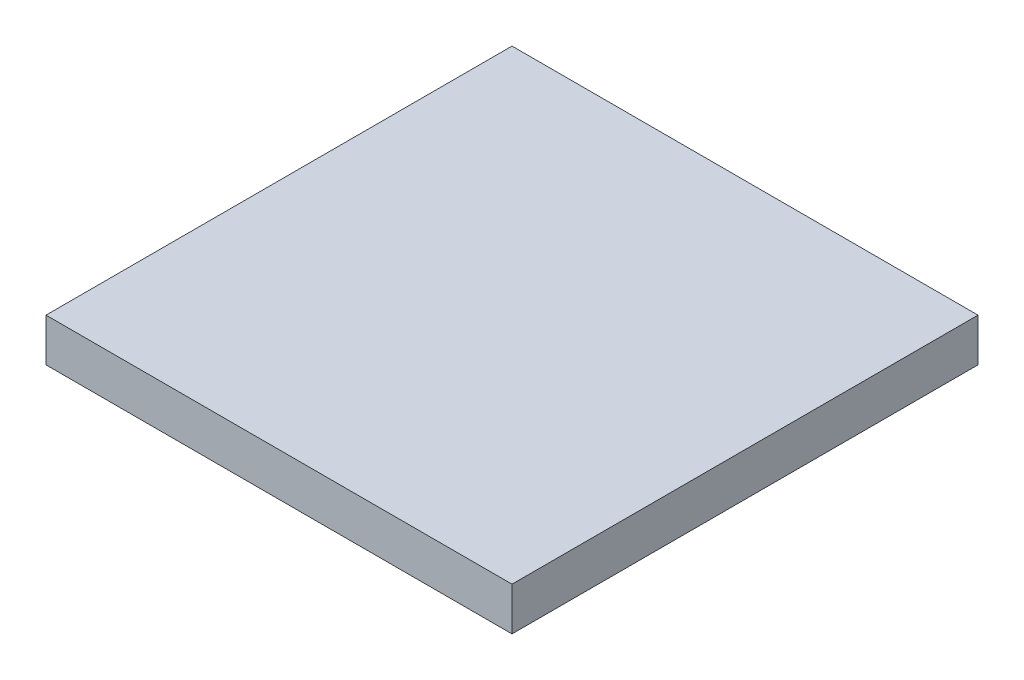
from build123d import *

# Parameters (mm, degrees)
SKETCH1_W           = 549.275
SKETCH1_H           = 549.275
BOSS_EXTRUDE1_DEPTH = 50.8


with BuildPart() as part:
    # Sketch1 → Boss-Extrude1 (new body)
    with BuildSketch(Plane(origin=(0, 0, 0), x_dir=(1, 0, 0), z_dir=(0, 1, 0))):
        Rectangle(SKETCH1_W, SKETCH1_H)
    extrude(amount=BOSS_EXTRUDE1_DEPTH)


solid = part.part
